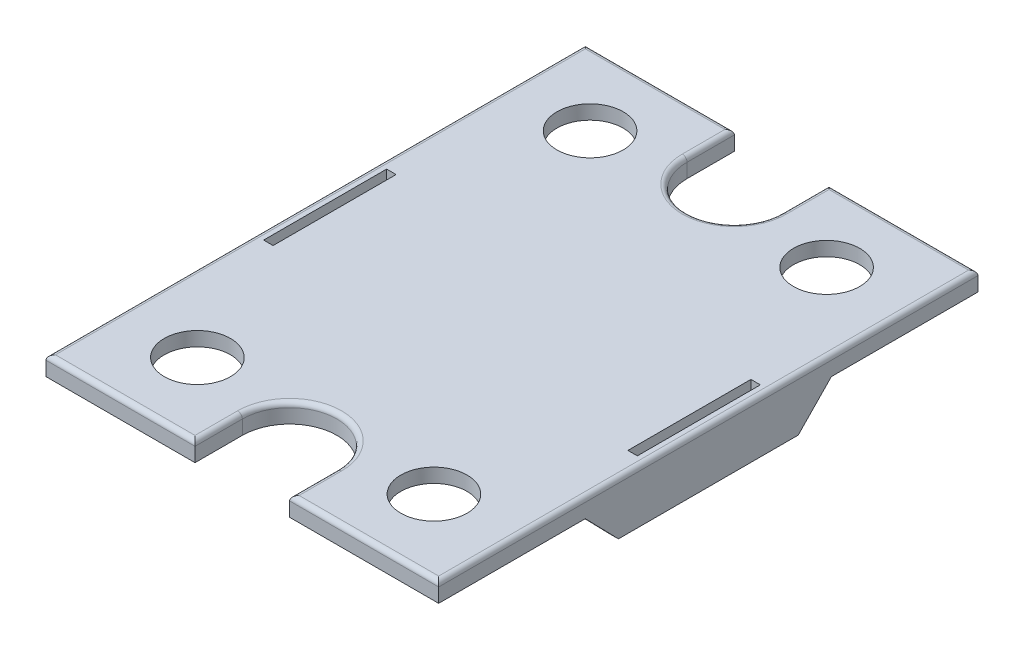
from build123d import *

# Parameters (mm, degrees)
SKETCH1_W           = 41.5
SKETCH1_H           = 57
BOSS_EXTRUDE1_DEPTH = 2
CUT_EXTRUDE1_DEPTH  = 36.310232228
SKETCH3_R           = 3.5
CUT_EXTRUDE2_DEPTH  = 36.310232228
SKETCH4_W           = 2
SKETCH4_H           = 13
CUT_EXTRUDE3_DEPTH  = 36.310232228
CUT_EXTRUDE4_DEPTH  = 0.5
BOSS_EXTRUDE2_DEPTH = 1
SKETCH7_W           = 3.5
SKETCH7_H           = 0.6
BOSS_EXTRUDE3_DEPTH = 0.3
FILLET1_R           = 0.5


with BuildPart() as part:
    # Sketch1 → Boss-Extrude1 (new body)
    with BuildSketch(Plane(origin=(0, 0, 0), x_dir=(1, 0, 0), z_dir=(0, 1, 0))):
        Rectangle(SKETCH1_W, SKETCH1_H)
    extrude(amount=BOSS_EXTRUDE1_DEPTH)

    # Sketch2 → Cut-Extrude1 (cut, through all)
    with BuildSketch(Plane(origin=(0, 2, 0), x_dir=(1, 0, 0), z_dir=(0, 1, 0))):
        with BuildLine():
            Line((-5, -23.5), (-5, -28.5))
            Line((-5, -28.5), (5, -28.5))
            Line((5, -28.5), (5, -23.5))
            ThreePointArc((5, -23.5), (0, -18.5), (-5, -23.5))
        make_face()
    cut_extrude1 = extrude(amount=-CUT_EXTRUDE1_DEPTH, mode=Mode.SUBTRACT)

    # Sketch3 → Cut-Extrude2 (cut, through all)
    with BuildSketch(Plane(origin=(0, 2, 0), x_dir=(1, 0, 0), z_dir=(0, 1, 0))):
        with Locations(Location((-12.5, -20.75, 0), (0, 0, 270))):
            Circle(SKETCH3_R)
        with Locations(Location((12.5, -20.75, 0), (0, 0, 90))):
            Circle(SKETCH3_R)
    cut_extrude2 = extrude(amount=-CUT_EXTRUDE2_DEPTH, mode=Mode.SUBTRACT)

    # Mirror1: Cut-Extrude1, Cut-Extrude2 across plane
    add(cut_extrude1.mirror(Plane.XY), mode=Mode.SUBTRACT)
    add(cut_extrude2.mirror(Plane.XY), mode=Mode.SUBTRACT)

    # Sketch4 → Cut-Extrude3 (cut, through all)
    with BuildSketch(Plane(origin=(0, 2, 0), x_dir=(1, 0, 0), z_dir=(0, 1, 0))):
        with Locations((-19.75, 0)):
            Rectangle(SKETCH4_W, SKETCH4_H)
        with Locations((19.75, 0)):
            Rectangle(SKETCH4_W, SKETCH4_H)
    extrude(amount=-CUT_EXTRUDE3_DEPTH, mode=Mode.SUBTRACT)

    # Sketch5 → Cut-Extrude4 (cut)
    with BuildSketch(Plane(origin=(0, 0, 0), x_dir=(1, 0, 0), z_dir=(0, 1, 0))):
        with BuildLine():
            Line((-18.75, 26.5), (-18.75, 8.5))
            Line((-18.75, 8.5), (-16.75, 8.5))
            Line((-16.75, 8.5), (-16.75, -8.5))
            Line((-16.75, -8.5), (-18.75, -8.5))
            Line((-18.75, -8.5), (-18.75, -26.5))
            Line((-18.75, -26.5), (-7, -26.5))
            Line((-7, -26.5), (-7, -23.5))
            ThreePointArc((-7, -23.5), (0, -16.5), (7, -23.5))
            Line((7, -23.5), (7, -26.5))
            Line((7, -26.5), (18.75, -26.5))
            Line((18.75, -26.5), (18.75, -8.5))
            Line((18.75, -8.5), (16.75, -8.5))
            Line((16.75, -8.5), (16.75, 8.5))
            Line((16.75, 8.5), (18.75, 8.5))
            Line((18.75, 8.5), (18.75, 26.5))
            Line((18.75, 26.5), (7, 26.5))
            Line((7, 26.5), (7, 23.5))
            ThreePointArc((7, 23.5), (0, 16.5), (-7, 23.5))
            Line((-7, 23.5), (-7, 26.5))
            Line((-7, 26.5), (-18.75, 26.5))
        make_face()
    extrude(amount=CUT_EXTRUDE4_DEPTH, mode=Mode.SUBTRACT)

    # Sketch6 → Boss-Extrude2 (add)
    with BuildSketch(Plane.ZY.offset(20.75)):
        Polygon((-13, 2), (13, 2), (13, 0), (9.5, -3.6), (-9.5, -3.6), (-13, 0), align=None)
    boss_extrude2 = extrude(amount=-BOSS_EXTRUDE2_DEPTH)

    # Sketch7 → Boss-Extrude3 (add)
    with BuildSketch(Plane(origin=(-19.75, 0, 0), x_dir=(0, 0, -1), z_dir=(1, 0, 0))):
        with Locations((-4.75, -3.3)):
            Rectangle(SKETCH7_W, SKETCH7_H)
        with Locations((4.75, -3.3)):
            Rectangle(SKETCH7_W, SKETCH7_H)
    boss_extrude3 = extrude(amount=BOSS_EXTRUDE3_DEPTH)

    # Mirror2: Boss-Extrude2, Boss-Extrude3 across plane
    add(boss_extrude2.mirror(Plane(origin=(0, 0, 0), x_dir=(0, 0, 1), z_dir=(1, 0, 0))))
    add(boss_extrude3.mirror(Plane(origin=(0, 0, 0), x_dir=(0, 0, 1), z_dir=(1, 0, 0))))

    # Fillet1
    fillet1_edges = [part.edges().sort_by_distance(p)[0] for p in [
        (-20.75, 2, 0),
        (-12.875, 2, 28.5),
        (12.875, 2, 28.5),
        (5, 2, 26),
        (0, 2, 18.5),
        (-5, 2, 26),
        (20.75, 2, 0),
        (-12.875, 2, -28.5),
        (5, 2, -26),
        (0, 2, -18.5),
        (-5, 2, -26),
        (12.875, 2, -28.5),
    ]]
    fillet(fillet1_edges, radius=FILLET1_R)


solid = part.part
